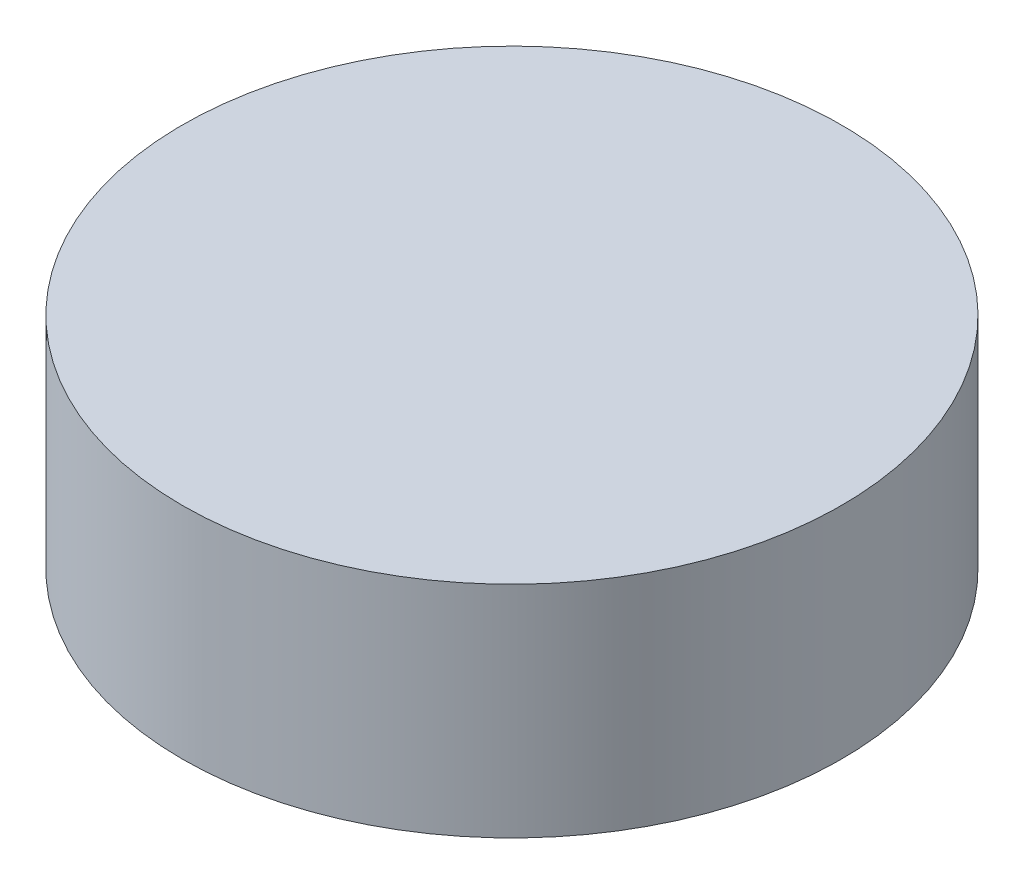
from build123d import *

# Parameters (mm, degrees)
SKETCH1_R           = 7.5
BOSS_EXTRUDE1_DEPTH = 5


with BuildPart() as part:
    # Sketch1 → Boss-Extrude1 (new body)
    with BuildSketch(Plane(origin=(0, 0, 0), x_dir=(1, 0, 0), z_dir=(0, 1, 0))):
        with Locations(Location((0, 0, 0), (0, 0, 270))):
            Circle(SKETCH1_R)
    extrude(amount=BOSS_EXTRUDE1_DEPTH)


solid = part.part
